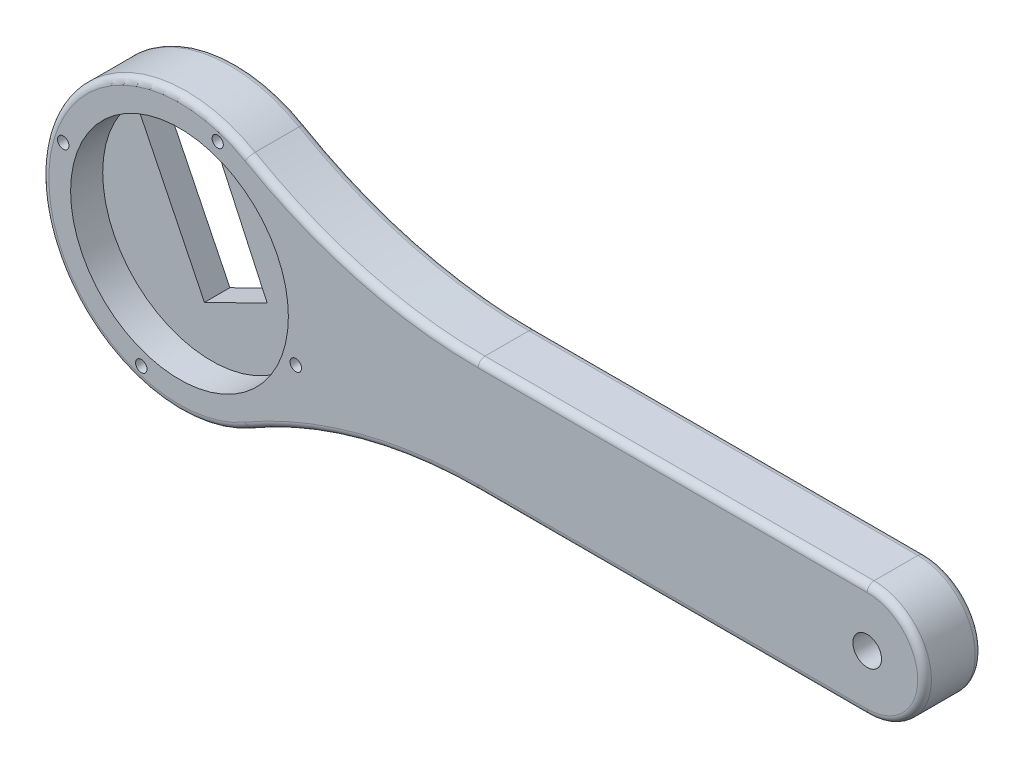
from build123d import *

# Parameters (mm, degrees)
SKETCH1_R               = 6.25
BOSS_EXTRUDE1_DEPTH     = 25.1
SKETCH3_R               = 47.5
CUT_EXTRUDE2_DEPTH      = 14
CUT_EXTRUDE5_DEPTH      = 332.443826311
CUT_EXTRUDE5_DEPTH_BACK = 332.443826311
SKETCH2_R               = 2.494998654
SKETCH2_R_2             = 2.5
SKETCH2_R_3             = 2.444443829
SKETCH6_R               = 3
CUT_EXTRUDE6_DEPTH      = 6
CUT_EXTRUDE7_DEPTH      = 331.788452035
CUT_EXTRUDE7_DEPTH_BACK = 331.788452035
FILLET1_R               = 200
FILLET2_R               = 3


with BuildPart() as part:
    # Sketch1 → Boss-Extrude1 (new body)
    with BuildSketch(Plane.XY):
        with BuildLine():
            Line((54.543560573, 25), (300, 25))
            ThreePointArc((300, 25), (325, 0), (300, -25))
            Line((300, -25), (54.543560573, -25))
            ThreePointArc((54.543560573, -25), (-60, 0), (54.543560573, 25))
        make_face()
        with Locations((300, 0)):
            Circle(SKETCH1_R, mode=Mode.SUBTRACT)
    extrude(amount=BOSS_EXTRUDE1_DEPTH)

    # Sketch3 → Cut-Extrude2 (cut)
    with BuildSketch(Plane.XY.offset(25.1)):
        Circle(SKETCH3_R)
    extrude(amount=-CUT_EXTRUDE2_DEPTH, mode=Mode.SUBTRACT)

    # Sketch2 → Cut-Extrude5 (cut, two sides: drawn at the far end of the back side and taken through both)
    with BuildSketch(Plane.XY.offset(25.1).offset(-CUT_EXTRUDE5_DEPTH_BACK)):
        with Locations((-16.664697145, -50.733104448)):
            Circle(SKETCH2_R)
        with Locations((-50.733105114, 16.664696544)):
            Circle(SKETCH2_R_2)
        with Locations((16.664695878, 50.733104512)):
            Circle(SKETCH2_R_3)
        with Locations((50.733103846, -16.66469648)):
            Circle(SKETCH2_R_2)
    extrude(amount=CUT_EXTRUDE5_DEPTH + CUT_EXTRUDE5_DEPTH_BACK, mode=Mode.SUBTRACT)

    # Sketch6 → Cut-Extrude6 (cut)
    with BuildSketch(Plane(origin=(0, 0, 0), x_dir=(-1, 0, 0), z_dir=(0, 0, -1))):
        with Locations((11.973502988, 47.212610548)):
            Circle(SKETCH6_R)
        with Locations((27.381285989, 40.029281029)):
            Circle(SKETCH6_R)
        with Locations((-19.717656658, -20.762902692)):
            Circle(SKETCH6_R)
        with Locations((-4.309873657, -27.946232212)):
            Circle(SKETCH6_R)
    extrude(amount=-CUT_EXTRUDE6_DEPTH, mode=Mode.SUBTRACT)

    # Sketch7 → Cut-Extrude7 (cut, two sides: drawn at the far end of the back side and taken through both)
    with BuildSketch(Plane.XY.offset(11.1).offset(-CUT_EXTRUDE7_DEPTH_BACK)):
        Polygon((-32.400942803, 32.871850778), (-3.10901045, -26.912408633), (24.254242539, -13.505492441), (-3.650778768, 46.958298756), align=None)
    extrude(amount=CUT_EXTRUDE7_DEPTH + CUT_EXTRUDE7_DEPTH_BACK, mode=Mode.SUBTRACT)

    # Fillet1
    fillet1_edges = [part.edges().sort_by_distance(p)[0] for p in [
        (54.543560573, 25, 12.55),
        (54.543560573, -25, 12.55),
    ]]
    fillet(fillet1_edges, radius=FILLET1_R)

    # Fillet2
    fillet2_edges = [part.edges().sort_by_distance(p)[0] for p in [
        (325, 0, 25.1),
        (215.144071104, 25, 25.1),
        (215.144071104, 25, 0),
        (325, 0, 0),
        (215.144071104, -25, 0),
        (215.144071104, -25, 25.1),
        (-60, 0, 0),
        (-60, 0, 25.1),
        (78.400690042, -31.848007239, 0),
        (78.400690042, -31.848007239, 25.1),
        (78.400690042, 31.848007239, 0),
        (78.400690042, 31.848007239, 25.1),
    ]]
    fillet(fillet2_edges, radius=FILLET2_R)


solid = part.part
